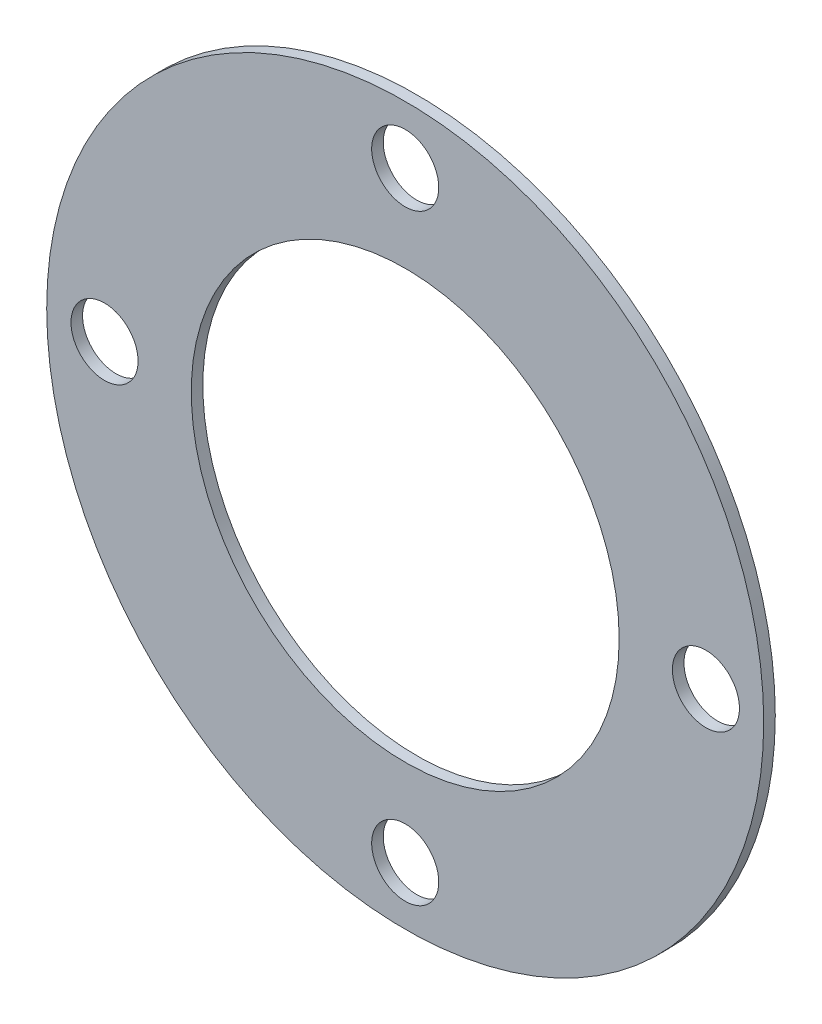
from build123d import *

# Parameters (mm, degrees)
SKETCH1_R            = 31
SKETCH1_R_2          = 18.5
BOSS_EXTRUDE1_DEPTH  = 1
M5_CLEARANCE_HOLE1_D = 5.8


with BuildPart() as part:
    # Sketch1 → Boss-Extrude1 (new body)
    with BuildSketch(Plane.XY):
        Circle(SKETCH1_R)
        Circle(SKETCH1_R_2, mode=Mode.SUBTRACT)
    extrude(amount=BOSS_EXTRUDE1_DEPTH)

    # M5 Clearance Hole1 (through all)
    with Locations(Plane.XY.offset(1)):
        with Locations((26, 0), (0, 26), (-26, 0), (0, -26)):
            Hole(M5_CLEARANCE_HOLE1_D / 2)


solid = part.part
